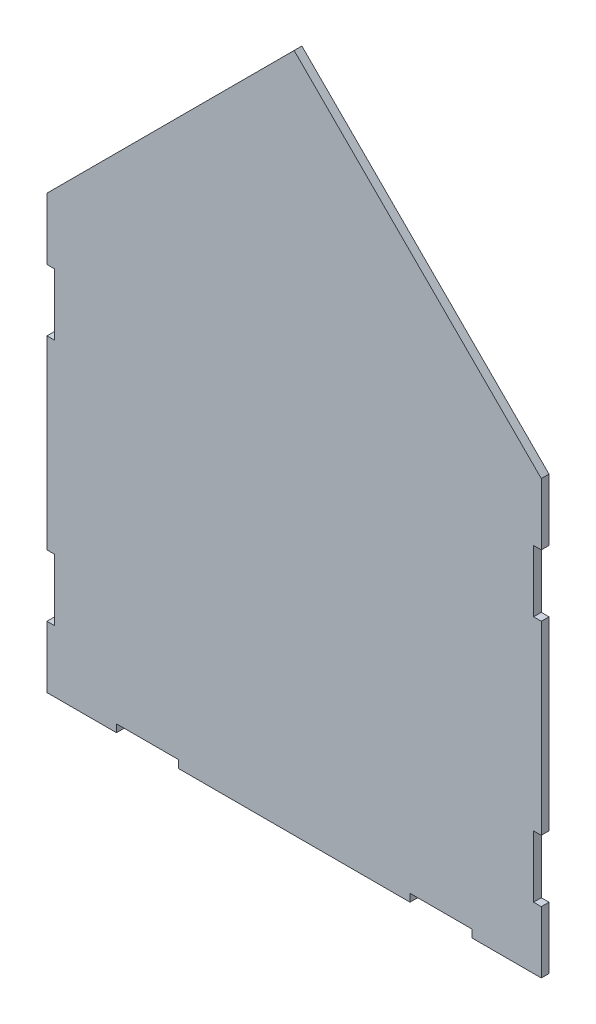
from build123d import *

# Parameters (mm, degrees)
BOSS_EXTRUDE1_DEPTH = 3.175


with BuildPart() as part:
    # Sketch2 → Boss-Extrude1 (new body)
    with BuildSketch(Plane.XY):
        Polygon((0.896774406, 279.4), (-100.703225594, 177.8), (-100.703225594, 152.4), (-97.528225594, 152.4), (-97.528225594, 127), (-100.703225594, 127), (-100.703225594, 50.8), (-97.528225594, 50.8), (-97.528225594, 25.4), (-100.703225594, 25.4), (-100.703225594, 0), (-72.128225594, 0), (-72.128225594, 3.175), (-46.728225594, 3.175), (-46.728225594, 0), (48.521774406, 0), (48.521774406, 3.175), (73.921774406, 3.175), (73.921774406, 0), (102.496774406, 0), (102.496774406, 25.4), (99.321774406, 25.4), (99.321774406, 50.8), (102.496774406, 50.8), (102.496774406, 127), (99.321774406, 127), (99.321774406, 152.4), (102.496774406, 152.4), (102.496774406, 177.8), align=None)
    extrude(amount=BOSS_EXTRUDE1_DEPTH)


solid = part.part
